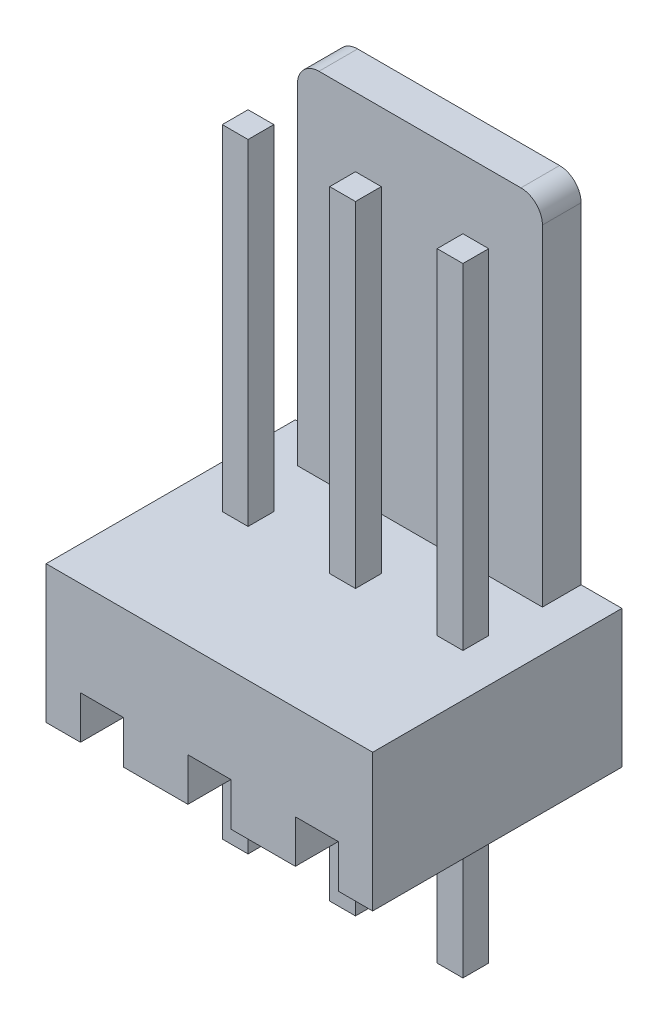
from build123d import *

# Parameters (mm, degrees)
CROQUIS1_W                   = 7.6
CROQUIS1_H                   = 5.8
SALIENTE_EXTRUIR1_DEPTH      = 3.2
CROQUIS2_W                   = 5.7
CROQUIS2_H                   = 0.9
SALIENTE_EXTRUIR2_DEPTH      = 8.2
REDONDEO2_R                  = 0.5
REDONDEO3_R                  = 0.5
CROQUIS3_W                   = 1
CROQUIS3_H                   = 5.8
CORTAR_EXTRUIR1_DEPTH        = 1
SALIENTE_EXTRUIR3_DEPTH      = 4.4
SALIENTE_EXTRUIR3_DEPTH_BACK = 10
CROQUIS4_W                   = 0.6
CROQUIS4_H                   = 0.6


with BuildPart() as part:
    # Croquis1 → Saliente-Extruir1 (new body)
    with BuildSketch(Plane(origin=(0, 0, 0), x_dir=(1, 0, 0), z_dir=(0, 1, 0))):
        Rectangle(CROQUIS1_W, CROQUIS1_H)
    extrude(amount=SALIENTE_EXTRUIR1_DEPTH)

    # Croquis2 → Saliente-Extruir2 (add)
    with BuildSketch(Plane(origin=(0, 3.2, 0), x_dir=(1, 0, 0), z_dir=(0, 1, 0))):
        with Locations((0, 2.45)):
            Rectangle(CROQUIS2_W, CROQUIS2_H)
    extrude(amount=SALIENTE_EXTRUIR2_DEPTH)

    # Redondeo2
    redondeo2_edges = [part.edges().sort_by_distance(p)[0] for p in [
        (2.85, 11.4, -2.45),
    ]]
    fillet(redondeo2_edges, radius=REDONDEO2_R)

    # Redondeo3
    redondeo3_edges = [part.edges().sort_by_distance(p)[0] for p in [
        (-2.85, 11.4, -2.45),
    ]]
    fillet(redondeo3_edges, radius=REDONDEO3_R)

    # Croquis3 → Cortar-Extruir1 (cut)
    with BuildSketch(Plane.XZ):
        with Locations((-2.5, 0)):
            Rectangle(CROQUIS3_W, CROQUIS3_H)
        Rectangle(CROQUIS3_W, CROQUIS3_H)
        with Locations((2.5, 0)):
            Rectangle(CROQUIS3_W, CROQUIS3_H)
    extrude(amount=-CORTAR_EXTRUIR1_DEPTH, mode=Mode.SUBTRACT)

    # Croquis4 → Saliente-Extruir3 (add, two sides: drawn at the far end of the back side and taken through both)
    with BuildSketch(Plane.XZ.offset(-1).offset(-SALIENTE_EXTRUIR3_DEPTH_BACK)):
        with Locations((-2.5, -0.5)):
            Rectangle(CROQUIS4_W, CROQUIS4_H)
        with Locations((0, -0.5)):
            Rectangle(CROQUIS4_W, CROQUIS4_H)
        with Locations((2.5, -0.5)):
            Rectangle(CROQUIS4_W, CROQUIS4_H)
    extrude(amount=SALIENTE_EXTRUIR3_DEPTH + SALIENTE_EXTRUIR3_DEPTH_BACK)


solid = part.part
